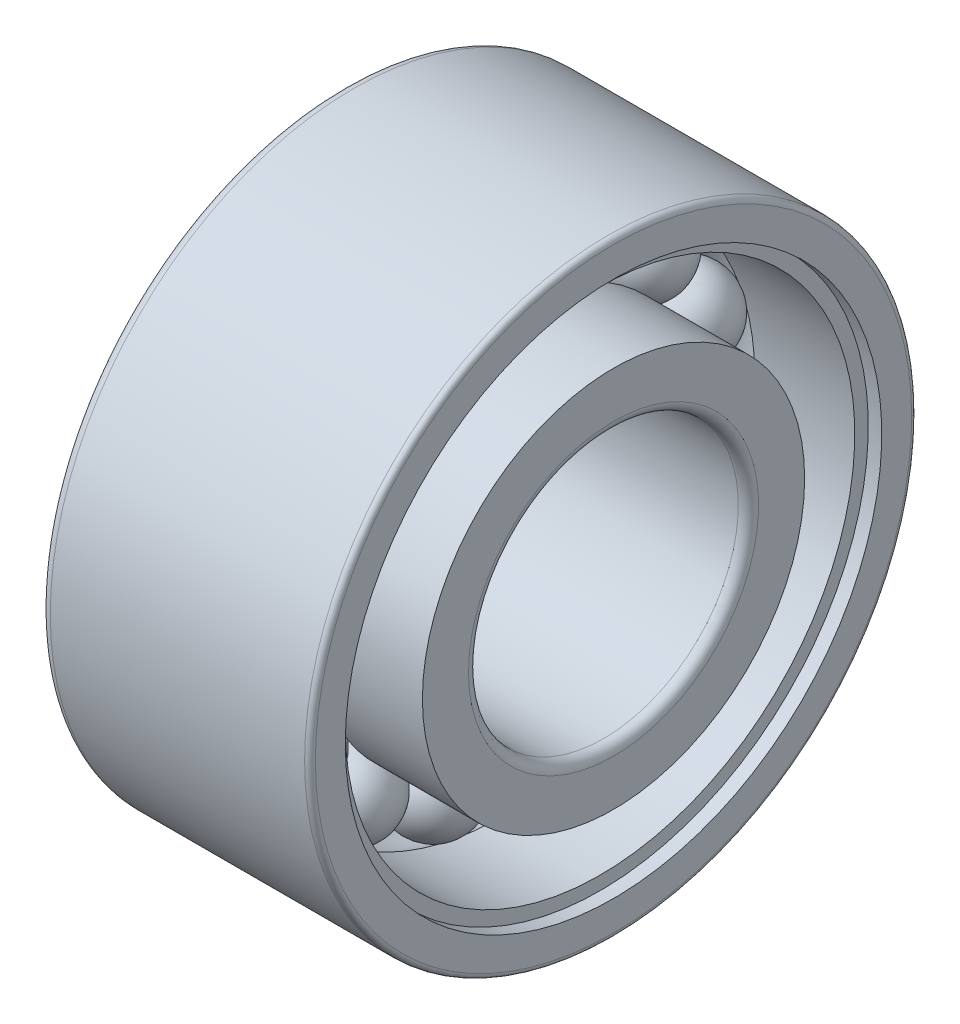
from build123d import *

# Parameters (mm, degrees)
CIRCULAR_PATTERN1_COUNT = 15
FILLET1_R               = 0.15
FILLET2_R               = 0.08


with BuildPart() as part:
    # Sketch1 → Revolve1 (revolve)
    with BuildSketch(Plane.XY):
        with BuildLine():
            Line((-0.625, 3.25), (0.625, 3.25))
            ThreePointArc((0.625, 3.25), (0, 2.625), (-0.625, 3.25))
        make_face()
    revolve1 = revolve(axis=Axis((-3.091912561, 3.25, 0), (1, 0, 0)))

    # Sketch2 → Revolve2 (revolve)
    with BuildSketch(Plane.XY, mode=Mode.PRIVATE) as revolve2_sk:
        with BuildLine():
            Line((-2, 2.833333333), (-0.452342668, 2.833333333))
            ThreePointArc((-0.452342668, 2.833333333), (0, 2.635), (0.452342668, 2.833333333))
            Line((0.452342668, 2.833333333), (2, 2.833333333))
            Line((2, 2.833333333), (2, 2))
            Line((2, 2), (-2, 2))
            Line((-2, 2), (-2, 2.833333333))
        make_face()
    revolve(revolve2_sk.sketch.rotate(Axis((-2.992358943, 0, 0), (1, 0, 0)), 90), axis=Axis((-2.992358943, 0, 0), (1, 0, 0)))

    # Sketch3 → Revolve3 (revolve)
    with BuildSketch(Plane.XY, mode=Mode.PRIVATE) as revolve3_sk:
        with BuildLine():
            Line((-2, 3.666666667), (-2, 4.5))
            Line((-2, 4.5), (2, 4.5))
            Line((2, 4.5), (2, 3.976666667))
            Line((2, 3.976666667), (1.8, 3.976666667))
            Line((1.8, 3.976666667), (1.8, 3.776666667))
            Line((1.8, 3.776666667), (0.317564517, 3.776666667))
            ThreePointArc((0.317564517, 3.776666667), (-0.086984409, 3.858817471), (-0.452342668, 3.666666667))
            Line((-0.452342668, 3.666666667), (-2, 3.666666667))
        make_face()
    revolve(revolve3_sk.sketch.rotate(Axis((-2.992358943, 0, 0), (1, 0, 0)), 90), axis=Axis((-2.992358943, 0, 0), (1, 0, 0)))

    # Circular-Pattern1: Revolve1 ×15 about axis
    circular_pattern1_axis = Axis((0, 0, 0), (1, 0, 0))
    for i in range(1, CIRCULAR_PATTERN1_COUNT):
        add(revolve1.rotate(circular_pattern1_axis, i * 360 / CIRCULAR_PATTERN1_COUNT))

    # Fillet1
    fillet1_edges = [part.edges().sort_by_distance(p)[0] for p in [
        (-2, 0, -4.5),
        (2, 0, -2),
    ]]
    fillet(fillet1_edges, radius=FILLET1_R)

    # Fillet2
    fillet2_edges = [part.edges().sort_by_distance(p)[0] for p in [
        (2, 0, -4.5),
        (-2, 0, -2),
    ]]
    fillet(fillet2_edges, radius=FILLET2_R)


solid = part.part
